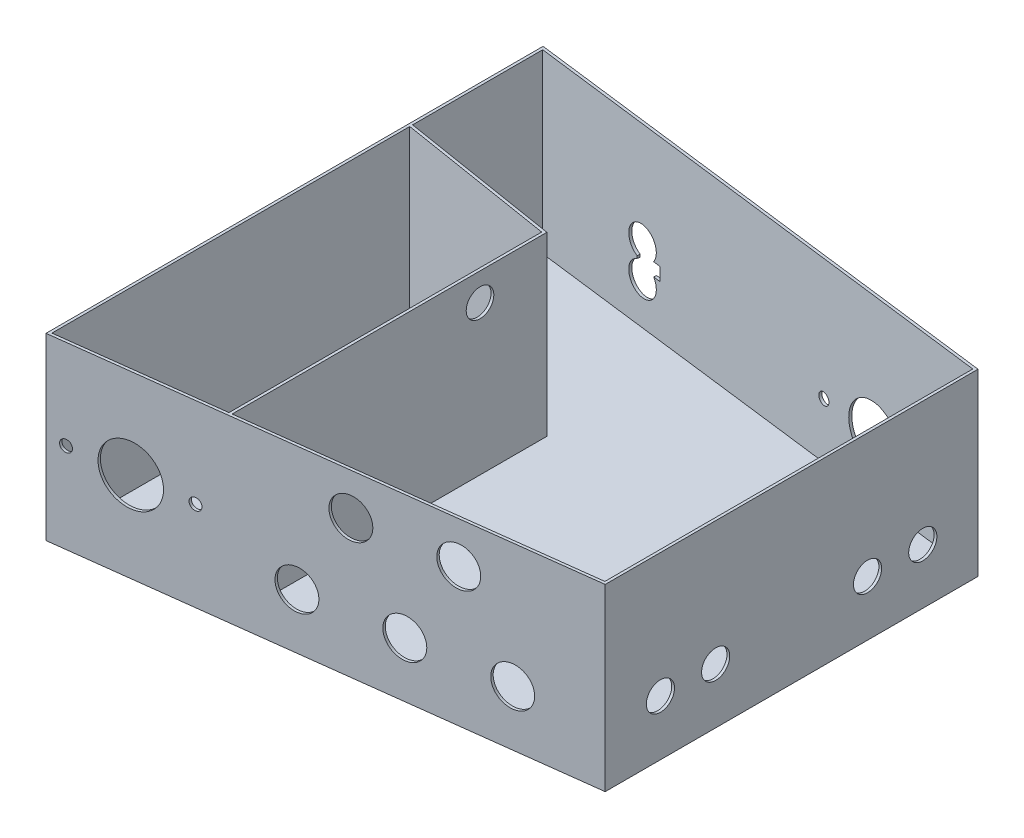
from build123d import *

# Parameters (mm, degrees)
BOSS_EXTRUDE2_DEPTH = 2
BOSS_EXTRUDE3_DEPTH = 128
BOSS_EXTRUDE4_DEPTH = 128
SKETCH4_R           = 21.25
SKETCH4_R_2         = 4.2
SKETCH4_R_3         = 14.25
CUT_EXTRUDE1_DEPTH  = 2
SKETCH5_R           = 10.2
CUT_EXTRUDE2_DEPTH  = 2
SKETCH6_R           = 21.25
SKETCH6_R_2         = 4.2
CUT_EXTRUDE3_DEPTH  = 2
SKETCH7_R           = 10
CUT_EXTRUDE4_DEPTH  = 2
SKETCH8_R           = 10
CUT_EXTRUDE5_DEPTH  = 2


with BuildPart() as part:
    # Sketch1 → Boss-Extrude2 (new body)
    with BuildSketch(Plane(origin=(0, 0, 0), x_dir=(1, 0, 0), z_dir=(0, 1, 0))):
        Polygon((174.285714286, -135), (174.285714286, 135), (-185.714285714, 180), (-185.714285714, -180), align=None)
    extrude(amount=BOSS_EXTRUDE2_DEPTH)



with BuildPart() as body_2:
    # Sketch2 → Boss-Extrude3 (new body)
    with BuildSketch(Plane(origin=(0, 2, 0), x_dir=(1, 0, 0), z_dir=(0, 1, 0))):
        Polygon((174.285714286, 135), (-185.714285714, 180), (-185.714285714, -180), (174.285714286, -135), align=None)
        Polygon((172.285714286, -133.234435563), (172.285714286, 133.234435563), (-183.714285714, 177.734435563), (-183.714285714, -177.734435563), align=None, mode=Mode.SUBTRACT)
    extrude(amount=BOSS_EXTRUDE3_DEPTH)


with BuildPart() as part_1:
    add(part.part)

    add(body_2.part)  # Boss-Extrude4 merges body 2
    # Sketch3 → Boss-Extrude4 (add)
    with BuildSketch(Plane(origin=(0, 2, 0), x_dir=(1, 0, 0), z_dir=(0, 1, 0))):
        Polygon((-67.714285714, 51.491616474), (-67.714285714, -165.25), (-69.714285714, -165.5), (-69.714285714, 51.491616474), (-69.714285714, 63.028269367), (-185.714285714, 81.762993886), (-185.714285714, 83.78891024), (-67.714285714, 64.731173228), align=None)
    extrude(amount=BOSS_EXTRUDE4_DEPTH)

    # Sketch4 → Cut-Extrude1 (cut)
    with BuildSketch(Plane(origin=(19.296703297, 0, 154.373626374), x_dir=(0.9922778767136677, 0, -0.12403473458920833), z_dir=(0.12403473458920831, 0, 0.9922778767136676))):
        with Locations((-151.60642933, 65)):
            Circle(SKETCH4_R)
        with Locations((-193.60642933, 65)):
            Circle(SKETCH4_R_2)
        with Locations((-109.60642933, 65)):
            Circle(SKETCH4_R_2)
        with Locations((-43.804830657, 40)):
            Circle(SKETCH4_R_3)
        with Locations((26.195169343, 40)):
            Circle(SKETCH4_R_3)
        with Locations((96.195169343, 40)):
            Circle(SKETCH4_R_3)
        with Locations((-8.804830657, 100)):
            Circle(SKETCH4_R_3)
        with Locations((61.195169343, 100)):
            Circle(SKETCH4_R_3)
    extrude(amount=-CUT_EXTRUDE1_DEPTH, mode=Mode.SUBTRACT)

    # Sketch5 → Cut-Extrude2 (cut)
    with BuildSketch(Plane(origin=(174.285714286, 0, 0), x_dir=(0, 0, -1), z_dir=(1, 0, 0))):
        with Locations((-95, 40)):
            Circle(SKETCH5_R)
        with Locations((-55, 40)):
            Circle(SKETCH5_R)
        with Locations((55, 40)):
            Circle(SKETCH5_R)
        with Locations((95, 40)):
            Circle(SKETCH5_R)
    extrude(amount=-CUT_EXTRUDE2_DEPTH, mode=Mode.SUBTRACT)

    # Sketch6 → Cut-Extrude3 (cut)
    with BuildSketch(Plane(origin=(19.296703297, 0, -154.373626374), x_dir=(-0.9922778767136676, 0, -0.12403473458920854), z_dir=(0.12403473458920855, 0, -0.9922778767136677))):
        with Locations((-72.195169343, 42)):
            Circle(SKETCH6_R)
        with Locations((-114.195169343, 42)):
            Circle(SKETCH6_R_2)
        with Locations((-30.195169343, 42)):
            Circle(SKETCH6_R_2)
        with BuildLine():
            Line((106.375385009, 43.91775074), (106.375385009, 48.66775074))
            Line((106.375385009, 48.66775074), (111.764772784, 48.66775074))
            ThreePointArc((111.764772784, 48.66775074), (124.150849168, 66.498884266), (125.575385009, 44.834745496))
            Line((125.575385009, 44.834745496), (125.575385009, 43.000755985))
            ThreePointArc((125.575385009, 43.000755985), (124.150849168, 21.336617215), (111.764772784, 39.16775074))
            Line((111.764772784, 39.16775074), (106.375385009, 39.16775074))
            Line((106.375385009, 39.16775074), (106.375385009, 43.91775074))
        make_face()
    extrude(amount=-CUT_EXTRUDE3_DEPTH, mode=Mode.SUBTRACT)

    # Sketch7 → Cut-Extrude4 (cut)
    with BuildSketch(Plane.ZY.offset(69.714285714)):
        with Locations((-16.333563693, 110)):
            Circle(SKETCH7_R)
    extrude(amount=-CUT_EXTRUDE4_DEPTH, mode=Mode.SUBTRACT)

    # Sketch8 → Cut-Extrude5 (cut)
    with BuildSketch(Plane.ZY.offset(185.714285714)):
        with Locations((-140, 40)):
            Circle(SKETCH8_R)
    extrude(amount=-CUT_EXTRUDE5_DEPTH, mode=Mode.SUBTRACT)


solid = part_1.part
